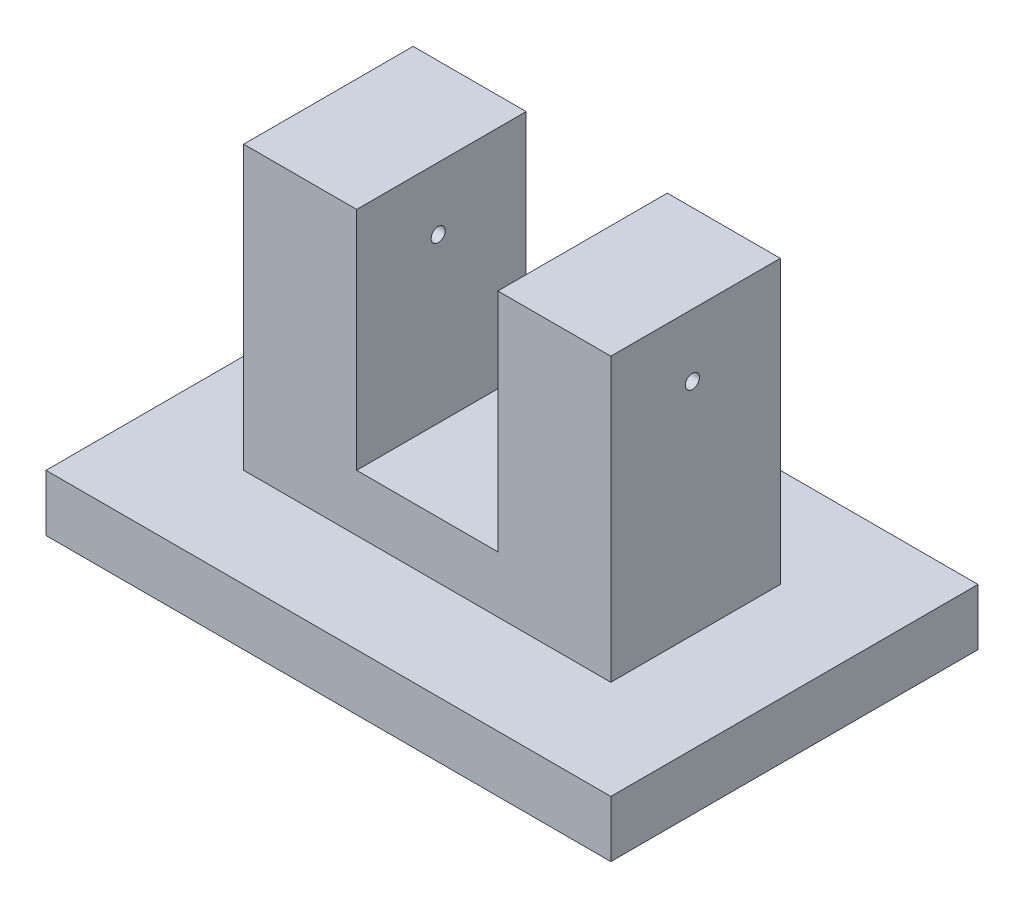
from build123d import *

# Parameters (mm, degrees)
SKETCH_1_W          = 20
SKETCH_1_H          = 13
EXTRUDE_1_DEPTH     = 2
SKETCH_2_W          = 13
SKETCH_2_H          = 6
EXTRUDE_2_DEPTH     = 2
SKETCH_3_W          = 4
SKETCH_3_H          = 6
EXTRUDE_3_DEPTH     = 8
SKETCH_4_R          = 0.25
CUT_EXTRUDE_1_DEPTH = 23.21940351


with BuildPart() as part:
    # 草图1 → 凸台-拉伸1 (new body)
    with BuildSketch(Plane(origin=(0, 0, 0), x_dir=(1, 0, 0), z_dir=(0, 1, 0))):
        with Locations((-4.02027027, 2.300675676)):
            Rectangle(SKETCH_1_W, SKETCH_1_H)
    extrude(amount=EXTRUDE_1_DEPTH)

    # 草图2 → 凸台-拉伸2 (add)
    with BuildSketch(Plane(origin=(0, 2, 0), x_dir=(1, 0, 0), z_dir=(0, 1, 0))):
        with Locations((-4.02027027, 2.300675676)):
            Rectangle(SKETCH_2_W, SKETCH_2_H)
    extrude(amount=EXTRUDE_2_DEPTH)

    # 草图3 → 凸台-拉伸3 (add)
    with BuildSketch(Plane(origin=(0, 4, 0), x_dir=(1, 0, 0), z_dir=(0, 1, 0))):
        with Locations((-8.52027027, 2.300675676)):
            Rectangle(SKETCH_3_W, SKETCH_3_H)
        with Locations((0.47972973, 2.300675676)):
            Rectangle(SKETCH_3_W, SKETCH_3_H)
    extrude(amount=EXTRUDE_3_DEPTH)

    # 草图4 → 切除-拉伸1 (cut, through all)
    with BuildSketch(Plane.ZY.offset(10.52027027)):
        with Locations((-2.187687032, 9.784017998)):
            Circle(SKETCH_4_R)
    extrude(amount=-CUT_EXTRUDE_1_DEPTH, mode=Mode.SUBTRACT)


solid = part.part
